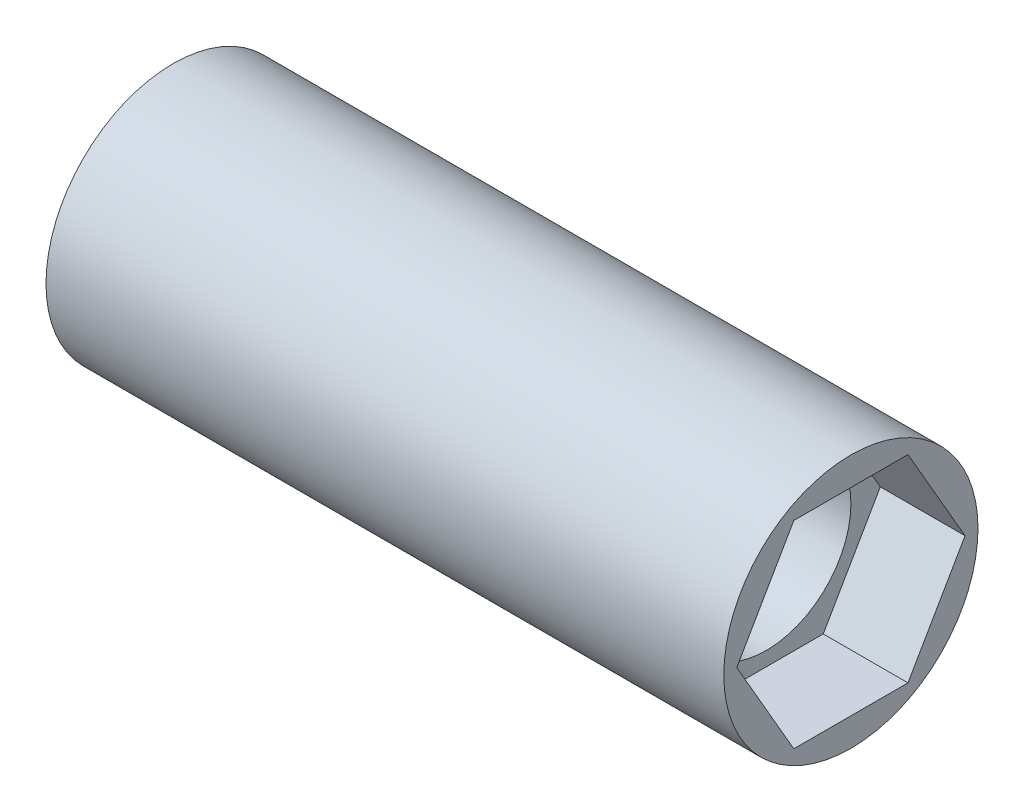
from build123d import *

# Parameters (mm, degrees)
SZKIC1_R                    = 4.5
SZKIC1_R_2                  = 3
DODANIE_WYCI_GNI_CIE1_DEPTH = 24
WYTNIJ_WYCI_GNI_CIE1_DEPTH  = 3


with BuildPart() as part:
    # Szkic1 → Dodanie-wyciągnięcie1 (new body)
    with BuildSketch(Plane(origin=(0, 0, 0), x_dir=(0, 0, -1), z_dir=(1, 0, 0))):
        Circle(SZKIC1_R)
        Circle(SZKIC1_R_2, mode=Mode.SUBTRACT)
    extrude(amount=DODANIE_WYCI_GNI_CIE1_DEPTH)

    # Szkic2 → Wytnij-wyciągnięcie1 (cut)
    with BuildSketch(Plane(origin=(24, 0, 0), x_dir=(0, 0, -1), z_dir=(1, 0, 0))):
        Polygon((4.041451884, 0), (2.020725942, 3.5), (-2.020725942, 3.5), (-4.041451884, 0), (-2.020725942, -3.5), (2.020725942, -3.5), align=None)
    extrude(amount=-WYTNIJ_WYCI_GNI_CIE1_DEPTH, mode=Mode.SUBTRACT)


solid = part.part
